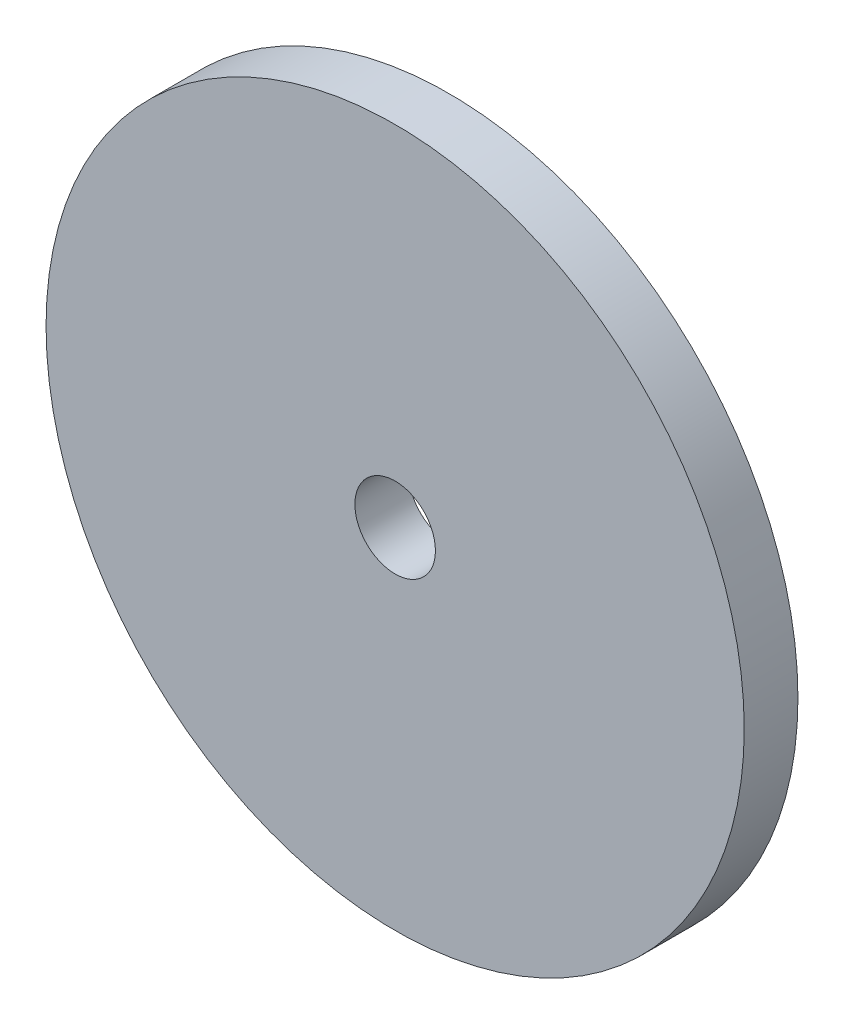
from build123d import *

# Parameters (mm, degrees)
SKETCH1_R           = 13
BOSS_EXTRUDE1_DEPTH = 2
SKETCH2_R           = 1.5
CUT_EXTRUDE1_DEPTH  = 10


with BuildPart() as part:
    # Sketch1 → Boss-Extrude1 (new body)
    with BuildSketch(Plane.XY):
        Circle(SKETCH1_R)
    extrude(amount=BOSS_EXTRUDE1_DEPTH)

    # Sketch2 → Cut-Extrude1 (cut)
    with BuildSketch(Plane.XY.offset(2)):
        Circle(SKETCH2_R)
    extrude(amount=-CUT_EXTRUDE1_DEPTH, mode=Mode.SUBTRACT)


solid = part.part
